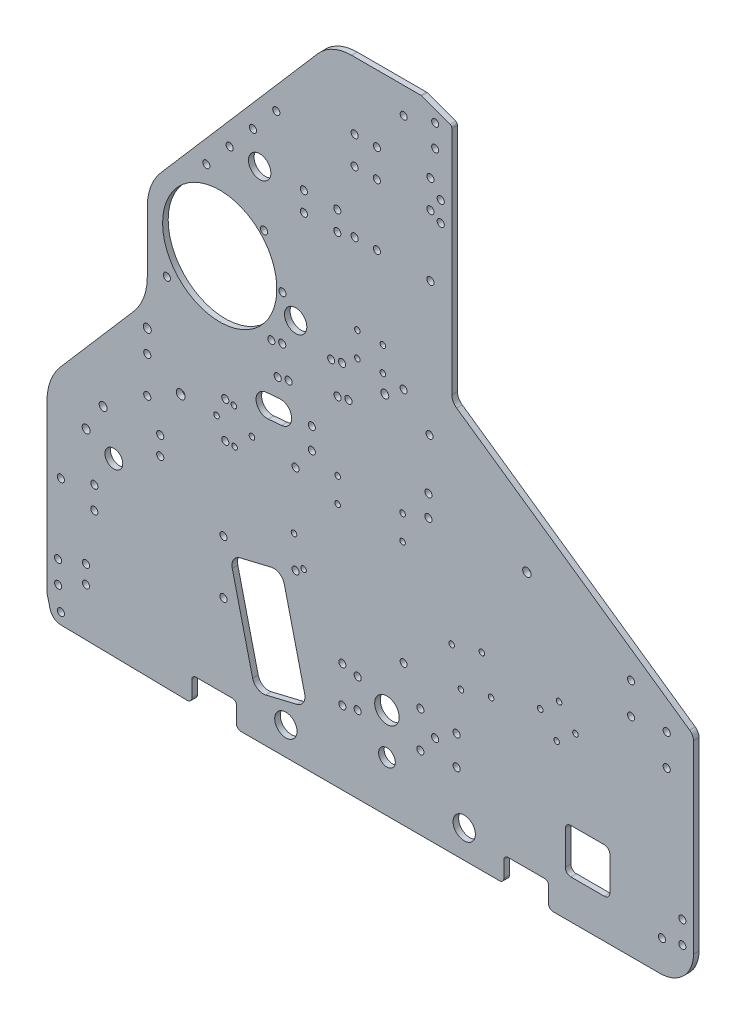
from build123d import *

# Parameters (mm, degrees)
SKETCH1_R           = 2.032
SKETCH1_R_2         = 5.08
SKETCH1_R_3         = 2.54
SKETCH1_R_4         = 2
BOSS_EXTRUDE1_DEPTH = 3.175
FILLET1_R           = 2.286
FILLET2_R           = 6.35
SKETCH2_R           = 2.032
CUT_EXTRUDE1_DEPTH  = 505.524983177
FILLET3_R           = 1.5875
SKETCH3_R           = 2.286
SKETCH3_R_2         = 2.032
SKETCH3_R_3         = 6.35
CUT_EXTRUDE2_DEPTH  = 505.524983177
SKETCH4_R           = 2.032
SKETCH4_R_2         = 6.985
SKETCH4_R_3         = 4.7625
CUT_EXTRUDE3_DEPTH  = 505.524983177
SKETCH5_R           = 32.54375
SKETCH5_R_2         = 6.35
SKETCH5_R_3         = 2.39
CUT_EXTRUDE5_DEPTH  = 505.524983177
FILLET4_R           = 31.75
CUT_EXTRUDE6_DEPTH  = 505.524983177
FILLET5_R           = 25.4
SKETCH8_R           = 2.031999998
SKETCH8_R_2         = 2.031999999
SKETCH8_R_3         = 2.032000002
CUT_EXTRUDE7_DEPTH  = 505.524983177
SKETCH10_R          = 2.032000004
CUT_EXTRUDE8_DEPTH  = 505.524983177
SKETCH11_RX         = 2.032
SKETCH11_RY         = 2.031999502
CUT_EXTRUDE9_DEPTH  = 505.524983177
SKETCH12_R          = 2.032
CUT_EXTRUDE10_DEPTH = 505.524983319
SKETCH14_R          = 6.375981846
CUT_EXTRUDE11_DEPTH = 505.524983319
SKETCH15_R          = 2.286
SKETCH15_R_2        = 2.159
CUT_EXTRUDE12_DEPTH = 505.524983319
FILLET7_R           = 5.08
FILLET8_R           = 2.54
SKETCH17_R          = 2.032
CUT_EXTRUDE13_DEPTH = 505.524983319
FILLET9_R           = 19.05
SKETCH18_R          = 1.5875
CUT_EXTRUDE14_DEPTH = 505.524983319


with BuildPart() as part:
    # Sketch1 → Boss-Extrude1 (new body)
    with BuildSketch(Plane.XY):
        with BuildLine():
            Line((7.829508682, -19.049081656), (82.55, -20.32))
            Line((82.55, -20.32), (82.55, -6.35))
            Line((82.55, -6.35), (107.95, -6.35))
            Line((107.95, -6.35), (107.95, -20.32))
            Line((107.95, -20.32), (260.35, -20.32))
            Line((260.35, -20.32), (260.35, -6.35))
            Line((260.35, -6.35), (285.75, -6.35))
            Line((285.75, -6.35), (285.75, -20.32))
            Line((285.75, -20.32), (368.3, -20.32))
            Line((368.3, -20.32), (368.3, 106.68))
            Line((368.3, 106.68), (230.66375, 202.565))
            Line((230.66375, 202.565), (230.66375, 338.455))
            Line((230.66375, 338.455), (213.19998, 344.805))
            Line((213.19998, 344.805), (203.2, 344.805))
            Line((203.2, 344.805), (161.925, 344.805))
            Line((161.925, 344.805), (52.720122664, 218.469945827))
            ThreePointArc((52.720122664, 218.469945827), (52.803835479, 218.142145922), (52.832, 217.805))
            ThreePointArc((52.832, 217.805), (52.095493096, 216.239521914), (50.419872403, 215.808871996))
            Line((50.419872403, 215.808871996), (0, 157.48))
            Line((0, 157.48), (0, 0))
            Line((0, 0), (0, -6.35))
            ThreePointArc((0, -6.35), (0.047577015, -7.125863724), (0.189595124, -7.890101219))
            Line((0.189595124, -7.890101219), (1.777095124, -14.240101219))
            ThreePointArc((1.777095124, -14.240101219), (3.987212552, -17.671692778), (7.829508682, -19.049081656))
        make_face()
        with Locations((7.9375, -12.7)):
            Circle(SKETCH1_R, mode=Mode.SUBTRACT)
        with Locations((6.35, 0)):
            Circle(SKETCH1_R, mode=Mode.SUBTRACT)
        with Locations((6.35, 12.7)):
            Circle(SKETCH1_R, mode=Mode.SUBTRACT)
        with Locations((38.1, 78.105)):
            Circle(SKETCH1_R_2, mode=Mode.SUBTRACT)
        with Locations((57.15, 118.58625)):
            Circle(SKETCH1_R, mode=Mode.SUBTRACT)
        with Locations((57.15, 139.22375)):
            Circle(SKETCH1_R, mode=Mode.SUBTRACT)
        with Locations((76.2, 128.905)):
            Circle(SKETCH1_R_3, mode=Mode.SUBTRACT)
        with Locations((101.6, 118.58625)):
            Circle(SKETCH1_R, mode=Mode.SUBTRACT)
        with Locations((101.6, 139.22375)):
            Circle(SKETCH1_R, mode=Mode.SUBTRACT)
        with BuildLine():
            ThreePointArc((126.021631534, 141.585225308), (119.142356235, 147.357622674), (124.914753602, 154.236897973))
            Line((124.914753602, 154.236897973), (132.505757201, 154.901024733))
            ThreePointArc((132.505757201, 154.901024733), (139.3850325, 149.128627367), (133.612635134, 142.249352067))
            Line((133.612635134, 142.249352067), (126.021631534, 141.585225308))
        make_face(mode=Mode.SUBTRACT)
        with Locations((203.2, 59.805)):
            Circle(SKETCH1_R_4, mode=Mode.SUBTRACT)
        with Locations((350.339487758, -2.359487758)):
            Circle(SKETCH1_R, mode=Mode.SUBTRACT)
        with Locations((361.95, 0)):
            Circle(SKETCH1_R, mode=Mode.SUBTRACT)
        with Locations((361.95, 12.7)):
            Circle(SKETCH1_R, mode=Mode.SUBTRACT)
        with Locations((353.06, 82.955052336)):
            Circle(SKETCH1_R, mode=Mode.SUBTRACT)
        with Locations((332.74, 98.195052336)):
            Circle(SKETCH1_R, mode=Mode.SUBTRACT)
        with Locations((332.74, 115.975052336)):
            Circle(SKETCH1_R, mode=Mode.SUBTRACT)
        with Locations((353.06, 100.735052336)):
            Circle(SKETCH1_R, mode=Mode.SUBTRACT)
        with Locations((68.326, 182.923674932)):
            Circle(SKETCH1_R, mode=Mode.SUBTRACT)
        with Locations((76.2, 217.805)):
            Circle(SKETCH1_R, mode=Mode.SUBTRACT)
        with Locations((90.779500502, 249.682)):
            Circle(SKETCH1_R, mode=Mode.SUBTRACT)
        with Locations((104.067838673, 265.054783374)):
            Circle(SKETCH1_R, mode=Mode.SUBTRACT)
        with Locations((117.356176844, 280.427566748)):
            Circle(SKETCH1_R, mode=Mode.SUBTRACT)
        with Locations((130.644515014, 295.800350122)):
            Circle(SKETCH1_R, mode=Mode.SUBTRACT)
        with Locations((203.2, 194.805)):
            Circle(SKETCH1_R_4, mode=Mode.SUBTRACT)
        with Locations((224.31375, 287.401)):
            Circle(SKETCH1_R, mode=Mode.SUBTRACT)
        with Locations((224.31375, 298.831)):
            Circle(SKETCH1_R, mode=Mode.SUBTRACT)
        with Locations((203.2, 329.805)):
            Circle(SKETCH1_R_4, mode=Mode.SUBTRACT)
        with Locations((221.138115, 322.58)):
            Circle(SKETCH1_R_4, mode=Mode.SUBTRACT)
        with Locations((221.138115, 335.28)):
            Circle(SKETCH1_R_4, mode=Mode.SUBTRACT)
    extrude(amount=BOSS_EXTRUDE1_DEPTH)

    # Fillet1
    fillet1_edges = [part.edges().sort_by_distance(p)[0] for p in [
        (285.75, -6.35, 1.5875),
        (260.35, -6.35, 1.5875),
        (107.95, -6.35, 1.5875),
        (82.55, -6.35, 1.5875),
    ]]
    fillet(fillet1_edges, radius=FILLET1_R)

    # Fillet2
    fillet2_edges = [part.edges().sort_by_distance(p)[0] for p in [
        (230.66375, 202.565, 1.5875),
    ]]
    fillet(fillet2_edges, radius=FILLET2_R)

    # Sketch2 → Cut-Extrude1 (cut, through all)
    with BuildSketch(Plane(origin=(0, 0, 0), x_dir=(-1, 0, 0), z_dir=(0, 0, -1))):
        with Locations((-100.552770272, 71.086035298)):
            Circle(SKETCH2_R)
        with Locations((-100.552770272, 40.606035298)):
            Circle(SKETCH2_R)
        with Locations((-22.225, 18.202541089)):
            Circle(SKETCH2_R)
        with Locations((-22.225, 8.042541089)):
            Circle(SKETCH2_R)
    extrude(amount=-CUT_EXTRUDE1_DEPTH, mode=Mode.SUBTRACT)

    # Fillet3
    fillet3_edges = [part.edges().sort_by_distance(p)[0] for p in [
        (213.19998, 344.805, 1.5875),
        (230.66375, 338.455, 1.5875),
    ]]
    fillet(fillet3_edges, radius=FILLET3_R)

    # Sketch3 → Cut-Extrude2 (cut, through all)
    # profile 1 of 13: a face of its own
    with BuildSketch(Plane.XY.offset(3.175)):
        with BuildLine():
            ThreePointArc((135.191487602, 64.820218836), (132.61355403, 68.506323892), (128.21466788, 69.445958198))
            ThreePointArc((128.21466788, 69.445958198), (128.001247395, 69.406624891), (127.789350211, 69.359774106))
            Line((127.789350211, 69.359774106), (110.090750339, 65.117184968))
            ThreePointArc((110.090750339, 65.117184968), (109.880641165, 65.062875232), (109.672582475, 65.00117439))
            ThreePointArc((109.672582475, 65.00117439), (106.177773017, 62.169316548), (105.55119507, 57.715047577))
            Line((105.55119507, 57.715047577), (105.782168144, 56.751508593))
            Line((105.782168144, 56.751508593), (116.9290648, 10.25054955))
            Line((116.9290648, 10.25054955), (117.160037875, 9.287010566))
            ThreePointArc((117.160037875, 9.287010566), (119.737971447, 5.60090551), (124.136857596, 4.661271205))
            ThreePointArc((124.136857596, 4.661271205), (124.350278082, 4.700604512), (124.562175266, 4.747455297))
            Line((124.562175266, 4.747455297), (142.260775137, 8.990044434))
            ThreePointArc((142.260775137, 8.990044434), (142.470884312, 9.044354171), (142.678943002, 9.106055013))
            ThreePointArc((142.678943002, 9.106055013), (146.17375246, 11.937912855), (146.800330407, 16.392181825))
            Line((146.800330407, 16.392181825), (146.569357332, 17.355720809))
            Line((146.569357332, 17.355720809), (135.422460676, 63.856679852))
            Line((135.422460676, 63.856679852), (135.191487602, 64.820218836))
        make_face()
        with BuildLine():
            ThreePointArc((123.720705737, 7.166948285), (123.84583827, 7.190010159), (123.970077661, 7.217479674))
            Line((123.970077661, 7.217479674), (141.668677532, 11.460068812))
            ThreePointArc((141.668677532, 11.460068812), (141.791868579, 11.491911654), (141.913857388, 11.528088044))
            ThreePointArc((141.913857388, 11.528088044), (143.962931337, 13.18846072), (144.330306029, 15.80008422))
            Line((144.330306029, 15.80008422), (144.099332955, 16.763623204))
            Line((144.099332955, 16.763623204), (132.952436299, 63.264582247))
            Line((132.952436299, 63.264582247), (132.721463224, 64.228121231))
            ThreePointArc((132.721463224, 64.228121231), (131.209971228, 66.389355466), (128.630819739, 66.940281117))
            ThreePointArc((128.630819739, 66.940281117), (128.505687207, 66.917219244), (128.381447816, 66.889749728))
            Line((128.381447816, 66.889749728), (110.682847944, 62.647160591))
            ThreePointArc((110.682847944, 62.647160591), (110.559656897, 62.615317748), (110.437668089, 62.579141359))
            ThreePointArc((110.437668089, 62.579141359), (108.388594139, 60.918768683), (108.021219448, 58.307145182))
            Line((108.021219448, 58.307145182), (108.252192522, 57.343606198))
            Line((108.252192522, 57.343606198), (119.399089178, 10.842647155))
            Line((119.399089178, 10.842647155), (119.630062252, 9.879108171))
            ThreePointArc((119.630062252, 9.879108171), (121.141554249, 7.717873936), (123.720705737, 7.166948285))
        make_face(mode=Mode.SUBTRACT)
    # profile 2 of 13: a face of its own
    with BuildSketch(Plane.XY.offset(3.175)):
        with BuildLine():
            ThreePointArc((119.630062252, 9.879108171), (121.141554249, 7.717873936), (123.720705737, 7.166948285))
            ThreePointArc((123.720705737, 7.166948285), (123.84583827, 7.190010159), (123.970077661, 7.217479674))
            Line((123.970077661, 7.217479674), (141.668677532, 11.460068812))
            ThreePointArc((141.668677532, 11.460068812), (141.791868579, 11.491911654), (141.913857388, 11.528088044))
            ThreePointArc((141.913857388, 11.528088044), (143.962931337, 13.18846072), (144.330306029, 15.80008422))
            Line((144.330306029, 15.80008422), (144.099332955, 16.763623204))
            Line((144.099332955, 16.763623204), (132.952436299, 63.264582247))
            Line((132.952436299, 63.264582247), (132.721463224, 64.228121231))
            ThreePointArc((132.721463224, 64.228121231), (131.209971228, 66.389355466), (128.630819739, 66.940281117))
            ThreePointArc((128.630819739, 66.940281117), (128.505687207, 66.917219244), (128.381447816, 66.889749728))
            Line((128.381447816, 66.889749728), (110.682847944, 62.647160591))
            ThreePointArc((110.682847944, 62.647160591), (110.559656897, 62.615317748), (110.437668089, 62.579141359))
            ThreePointArc((110.437668089, 62.579141359), (108.388594139, 60.918768683), (108.021219448, 58.307145182))
            Line((108.021219448, 58.307145182), (108.252192522, 57.343606198))
            Line((108.252192522, 57.343606198), (119.399089178, 10.842647155))
            Line((119.399089178, 10.842647155), (119.630062252, 9.879108171))
        make_face()
        with BuildLine():
            add(Edge.make_bspline(
                [(137.838301681, 15.683526575), (141.086601391, 16.4621871), (140.016434861, 20.926548037)],
                knots=[6.015286395, 6.015286395, 6.015286395, 6.934634014, 6.934634014, 6.934634014], degree=2, weights=[1, 0.896197261, 1]))
            Line((140.016434861, 20.926548037), (131.200631138, 57.703001655))
            add(Edge.make_bspline(
                [(131.200631138, 57.703001655), (130.130464608, 62.167362592), (126.882164897, 61.388702067)],
                knots=[2.490143946, 2.490143946, 2.490143946, 3.409491566, 3.409491566, 3.409491566], degree=2, weights=[1, 0.896197261, 1]))
            Line((126.882164897, 61.388702067), (114.513223796, 58.423702828))
            add(Edge.make_bspline(
                [(114.513223796, 58.423702828), (111.264924085, 57.645042303), (112.335090616, 53.180681366)],
                knots=[2.873693741, 2.873693741, 2.873693741, 3.793041361, 3.793041361, 3.793041361], degree=2, weights=[1, 0.896197261, 1]))
            Line((112.335090616, 53.180681366), (121.150894339, 16.404227747))
            add(Edge.make_bspline(
                [(121.150894339, 16.404227747), (122.221060869, 11.93986681), (125.46936058, 12.718527335)],
                knots=[2.490143946, 2.490143946, 2.490143946, 3.409491566, 3.409491566, 3.409491566], degree=2, weights=[1, 0.896197261, 1]))
            Line((125.46936058, 12.718527335), (137.838301681, 15.683526575))
        make_face(mode=Mode.SUBTRACT)
    # profile 3 of 13: a face of its own
    with BuildSketch(Plane.XY.offset(3.175)):
        with BuildLine():
            Line((137.838301681, 15.683526575), (125.46936058, 12.718527335))
            add(Edge.make_bspline(
                [(121.150894339, 16.404227747), (122.221060869, 11.93986681), (125.46936058, 12.718527335)],
                knots=[2.490143946, 2.490143946, 2.490143946, 3.409491566, 3.409491566, 3.409491566], degree=2, weights=[1, 0.896197261, 1]))
            Line((121.150894339, 16.404227747), (112.335090616, 53.180681366))
            add(Edge.make_bspline(
                [(114.513223796, 58.423702828), (111.264924085, 57.645042303), (112.335090616, 53.180681366)],
                knots=[2.873693741, 2.873693741, 2.873693741, 3.793041361, 3.793041361, 3.793041361], degree=2, weights=[1, 0.896197261, 1]))
            Line((114.513223796, 58.423702828), (126.882164897, 61.388702067))
            add(Edge.make_bspline(
                [(131.200631138, 57.703001655), (130.130464608, 62.167362592), (126.882164897, 61.388702067)],
                knots=[2.490143946, 2.490143946, 2.490143946, 3.409491566, 3.409491566, 3.409491566], degree=2, weights=[1, 0.896197261, 1]))
            Line((131.200631138, 57.703001655), (140.016434861, 20.926548037))
            add(Edge.make_bspline(
                [(137.838301681, 15.683526575), (141.086601391, 16.4621871), (140.016434861, 20.926548037)],
                knots=[6.015286395, 6.015286395, 6.015286395, 6.934634014, 6.934634014, 6.934634014], degree=2, weights=[1, 0.896197261, 1]))
        make_face()
    # profile 4 of 13: a face of its own
    with BuildSketch(Plane.XY.offset(3.175)):
        with Locations((32.030600949, 100.810868853)):
            Circle(SKETCH3_R)
    # profile 5 of 13: a face of its own
    with BuildSketch(Plane.XY.offset(3.175)):
        with Locations((64.525942114, 92.525786339)):
            Circle(SKETCH3_R_2)
    # profile 6 of 13: a face of its own
    with BuildSketch(Plane.XY.offset(3.175)):
        with Locations((64.525942114, 102.94048958)):
            Circle(SKETCH3_R_2)
    # profile 7 of 13: a face of its own
    with BuildSketch(Plane.XY.offset(3.175)):
        with Locations((7.937500002, 53.303113935)):
            Circle(SKETCH3_R_2)
    # profile 8 of 13: a face of its own
    with BuildSketch(Plane.XY.offset(3.175)):
        with Locations((26.987500002, 59.653113935)):
            Circle(SKETCH3_R_2)
    # profile 9 of 13: a face of its own
    with BuildSketch(Plane.XY.offset(3.175)):
        with Locations((26.987500002, 46.953113935)):
            Circle(SKETCH3_R_2)
    # profile 10 of 13: a face of its own
    with BuildSketch(Plane.XY.offset(3.175)):
        with Locations((123.681970341, 233.485092108)):
            Circle(SKETCH3_R_2)
    # profile 11 of 13: a face of its own
    with BuildSketch(Plane.XY.offset(3.175)):
        with Locations((134.14375, 208.228121768)):
            Circle(SKETCH3_R_2)
    # profile 12 of 13: a face of its own
    with BuildSketch(Plane.XY.offset(3.175)):
        with Locations((136.094563167, -4.324155877)):
            Circle(SKETCH3_R_3)
    # profile 13 of 13: a face of its own
    with BuildSketch(Plane.XY.offset(3.175)):
        with Locations((237.694563167, -4.324155877)):
            Circle(SKETCH3_R_3)
    extrude(amount=-CUT_EXTRUDE2_DEPTH, mode=Mode.SUBTRACT)

    # Sketch4 → Cut-Extrude3 (cut, through all)
    with BuildSketch(Plane.XY.offset(3.175)):
        with Locations((168.275, 42.06875)):
            Circle(SKETCH4_R)
        with Locations((212.725, 42.06875)):
            Circle(SKETCH4_R)
        with Locations((212.725, 21.43125)):
            Circle(SKETCH4_R)
        with Locations((168.275, 21.43125)):
            Circle(SKETCH4_R)
        with Locations((193.675, 31.75)):
            Circle(SKETCH4_R_2)
        with Locations((177.00498, 40.0431)):
            Circle(SKETCH4_R)
        with Locations((177.00498, 23.4569)):
            Circle(SKETCH4_R)
        with Locations((193.675, 8.466666658)):
            Circle(SKETCH4_R_3)
        with Locations((221.138115, 31.75)):
            Circle(SKETCH4_R)
        with Locations((233.36123, 23.4569)):
            Circle(SKETCH4_R)
        with Locations((233.36123, 40.0431)):
            Circle(SKETCH4_R)
    extrude(amount=-CUT_EXTRUDE3_DEPTH, mode=Mode.SUBTRACT)

    # Sketch5 → Cut-Extrude5 (cut, through all)
    with BuildSketch(Plane(origin=(0, 0, 0), x_dir=(-1, 0, 0), z_dir=(0, 0, -1))):
        with Locations((-98.425, 208.228121768)):
            Circle(SKETCH5_R)
        with Locations((-141.675587431, 197.971943782)):
            Circle(SKETCH5_R_2)
        with Locations((-273.4056, 139.72794)):
            Circle(SKETCH5_R_3)
        Polygon((-57.15, 223.594705882), (-57.15, 165.333696112), (0, 99.218990229), (0, 157.48), align=None)
    extrude(amount=-CUT_EXTRUDE5_DEPTH, mode=Mode.SUBTRACT)

    # Fillet4
    fillet4_edges = [part.edges().sort_by_distance(p)[0] for p in [
        (57.15, 223.594705882, 1.5875),
        (0, 99.218990229, 1.5875),
        (57.15, 165.333696112, 1.5875),
    ]]
    fillet(fillet4_edges, radius=FILLET4_R)

    # Sketch6 → Cut-Extrude6 (cut, through all)
    with BuildSketch(Plane.XY.offset(3.175)):
        with BuildLine():
            Line((298.45, 27.305), (317.5, 27.305))
            ThreePointArc((317.5, 27.305), (319.74506403, 26.37506403), (320.675, 24.13))
            Line((320.675, 24.13), (320.675, 5.08))
            ThreePointArc((320.675, 5.08), (319.74506403, 2.83493597), (317.5, 1.905))
            Line((317.5, 1.905), (298.45, 1.905))
            ThreePointArc((298.45, 1.905), (296.20493597, 2.83493597), (295.275, 5.08))
            Line((295.275, 5.08), (295.275, 24.13))
            ThreePointArc((295.275, 24.13), (296.20493597, 26.37506403), (298.45, 27.305))
        make_face()
    extrude(amount=-CUT_EXTRUDE6_DEPTH, mode=Mode.SUBTRACT)

    # Fillet5
    fillet5_edges = [part.edges().sort_by_distance(p)[0] for p in [
        (161.925, 344.805, 1.5875),
    ]]
    fillet(fillet5_edges, radius=FILLET5_R)

    # Sketch8 → Cut-Extrude7 (cut, through all)
    with BuildSketch(Plane(origin=(0, 0, 0), x_dir=(-1, 0, 0), z_dir=(0, 0, -1))):
        with Locations((-218.44, 306.70500001)):
            Circle(SKETCH8_R)
        with Locations((-175.26, 306.70500001)):
            Circle(SKETCH8_R_2)
        with Locations((-175.26, 255.905)):
            Circle(SKETCH8_R_3)
        with Locations((-218.44, 255.905)):
            Circle(SKETCH8_R_3)
        with Locations((-187.96, 306.70500001)):
            Circle(SKETCH8_R_2)
        with Locations((-187.96, 255.905)):
            Circle(SKETCH8_R_3)
        with Locations((-218.44, 290.83)):
            Circle(SKETCH8_R_3)
        with Locations((-187.96, 290.83)):
            Circle(SKETCH8_R_3)
        with Locations((-175.26, 290.83)):
            Circle(SKETCH8_R_3)
    extrude(amount=-CUT_EXTRUDE7_DEPTH, mode=Mode.SUBTRACT)

    # Sketch10 → Cut-Extrude8 (cut, through all)
    with BuildSketch(Plane.XY.offset(3.175)):
        with Locations((141.642479994, 74.684371768)):
            Circle(SKETCH10_R)
        with Locations((141.642479994, 125.484371768)):
            Circle(SKETCH10_R)
    extrude(amount=-CUT_EXTRUDE8_DEPTH, mode=Mode.SUBTRACT)

    # Sketch11 → Cut-Extrude9 (cut, through all)
    with BuildSketch(Plane.XY.offset(3.175)):
        with Locations(Location((150.881424454, 138.43), (0, 0, 90))):
            Ellipse(SKETCH11_RX, SKETCH11_RY)
        with Locations(Location((150.881424454, 150.495), (0, 0, 90))):
            Ellipse(SKETCH11_RX, SKETCH11_RY)
        with Locations(Location((217.30240818, 150.495), (0, 0, 90))):
            Ellipse(SKETCH11_RX, SKETCH11_RY)
        with Locations(Location((217.30240818, 138.43), (0, 0, 90))):
            Ellipse(SKETCH11_RX, SKETCH11_RY)
    extrude(amount=-CUT_EXTRUDE9_DEPTH, mode=Mode.SUBTRACT)

    # Sketch12 → Cut-Extrude10 (cut, through all)
    with BuildSketch(Plane(origin=(0, 0, 0), x_dir=(-1, 0, 0), z_dir=(0, 0, -1))):
        with Locations((-165.4175, 264.63498)):
            Circle(SKETCH12_R)
        with Locations((-165.4175, 253.52248)):
            Circle(SKETCH12_R)
        with Locations((-146.3675, 253.52248)):
            Circle(SKETCH12_R)
        with Locations((-146.3675, 264.63498)):
            Circle(SKETCH12_R)
    extrude(amount=-CUT_EXTRUDE10_DEPTH, mode=Mode.SUBTRACT)

    # Sketch14 → Cut-Extrude11 (cut, through all)
    with BuildSketch(Plane(origin=(0, 0, 0), x_dir=(-1, 0, 0), z_dir=(0, 0, -1))):
        with Locations((-121.184716432, 263.688494682)):
            Circle(SKETCH14_R)
    extrude(amount=-CUT_EXTRUDE11_DEPTH, mode=Mode.SUBTRACT)

    # Sketch15 → Cut-Extrude12 (cut, through all)
    with BuildSketch(Plane.XY.offset(3.175)):
        with Locations((57.149999979, 151.92375)):
            Circle(SKETCH15_R)
        with Locations((192.439038935, 187.119947783)):
            Circle(SKETCH15_R)
        with Locations((38.100000021, 78.105)):
            Circle(SKETCH15_R_2)
        with Locations((22.359447548, 84.872674248)):
            Circle(SKETCH15_R)
        with BuildLine():
            ThreePointArc((163.873739907, 173.680575348), (163.573171678, 172.102507308), (164.512499377, 170.799317578))
            ThreePointArc((164.512499377, 170.799317578), (167.54083865, 172.982117899), (163.873739907, 173.680575348))
        make_face()
        with BuildLine():
            ThreePointArc((173.439750066, 172.778441407), (173.740318296, 174.356509448), (172.800990596, 175.659699178))
            ThreePointArc((172.800990596, 175.659699178), (169.772651323, 173.476898857), (173.439750066, 172.778441407))
        make_face()
        with BuildLine():
            ThreePointArc((169.158852993, 192.088320238), (166.130513719, 189.905519916), (169.797612462, 189.207062467))
            ThreePointArc((169.797612462, 189.207062467), (170.098180692, 190.785130507), (169.158852993, 192.088320238))
        make_face()
        with BuildLine():
            ThreePointArc((160.231602304, 190.109196408), (159.931034074, 188.531128368), (160.870361773, 187.227938637))
            ThreePointArc((160.870361773, 187.227938637), (163.898701047, 189.410738959), (160.231602304, 190.109196408))
        make_face()
        with BuildLine():
            ThreePointArc((129.776601859, 166.121421831), (129.476033629, 164.543353791), (130.415361328, 163.240164061))
            ThreePointArc((130.415361328, 163.240164061), (133.443700602, 165.422964382), (129.776601859, 166.121421831))
        make_face()
        with BuildLine():
            ThreePointArc((139.342612017, 165.219287891), (139.643180247, 166.797355931), (138.703852548, 168.100545661))
            ThreePointArc((138.703852548, 168.100545661), (135.675513274, 165.91774534), (139.342612017, 165.219287891))
        make_face()
        with BuildLine():
            ThreePointArc((135.700474414, 181.64790895), (136.001042643, 183.225976991), (135.061714944, 184.529166721))
            ThreePointArc((135.061714944, 184.529166721), (132.033375671, 182.3463664), (135.700474414, 181.64790895))
        make_face()
        with BuildLine():
            ThreePointArc((126.134464255, 182.550042891), (125.833896025, 180.971974851), (126.773223725, 179.668785121))
            ThreePointArc((126.773223725, 179.668785121), (129.801562998, 181.851585442), (126.134464255, 182.550042891))
        make_face()
    extrude(amount=-CUT_EXTRUDE12_DEPTH, mode=Mode.SUBTRACT)

    # Fillet7
    fillet7_edges = [part.edges().sort_by_distance(p)[0] for p in [
        (368.3, 106.68, 1.5875),
    ]]
    fillet(fillet7_edges, radius=FILLET7_R)

    # Fillet8
    fillet8_edges = [part.edges().sort_by_distance(p)[0] for p in [
        (285.75, -20.32, 1.5875),
        (260.35, -20.32, 1.5875),
        (107.95, -20.32, 1.5875),
        (82.55, -20.32, 1.5875),
    ]]
    fillet(fillet8_edges, radius=FILLET8_R)

    # Sketch17 → Cut-Extrude13 (cut, through all)
    with BuildSketch(Plane.XY.offset(3.175)):
        with Locations((217.96375, 179.705)):
            Circle(SKETCH17_R)
    extrude(amount=-CUT_EXTRUDE13_DEPTH, mode=Mode.SUBTRACT)

    # Fillet9
    fillet9_edges = [part.edges().sort_by_distance(p)[0] for p in [
        (368.3, -20.32, 1.5875),
    ]]
    fillet(fillet9_edges, radius=FILLET9_R)

    # Sketch18 → Cut-Extrude14 (cut, through all)
    with BuildSketch(Plane.XY.offset(3.175)):
        with Locations((165.591916317, 119.38)):
            Circle(SKETCH18_R)
        with Locations((202.591916317, 119.38)):
            Circle(SKETCH18_R)
        with Locations((176.814816317, 210.82)):
            Circle(SKETCH18_R)
        with Locations((191.369016317, 210.82)):
            Circle(SKETCH18_R)
        with Locations((165.591916317, 133.35)):
            Circle(SKETCH18_R)
        with Locations((202.591916317, 133.35)):
            Circle(SKETCH18_R)
        with Locations((235.829835721, 63.104098689)):
            Circle(SKETCH18_R)
        with Locations((253.003996913, 67.705901311)):
            Circle(SKETCH18_R)
        with Locations((230.570632725, 82.731711479)):
            Circle(SKETCH18_R)
        with Locations((247.744793916, 87.333514101)):
            Circle(SKETCH18_R)
        with Locations((140.737131429, 92.548810178)):
            Circle(SKETCH18_R)
        with Locations((146.166701205, 77.631189823)):
            Circle(SKETCH18_R)
        with Locations((116.781916317, 128.27)):
            Circle(SKETCH18_R)
        with Locations((106.490542802, 138.561373515)):
            Circle(SKETCH18_R)
        with Locations((281.014286603, 76.059582017)):
            Circle(SKETCH18_R)
        with Locations((290.369546031, 64.910417983)):
            Circle(SKETCH18_R)
        with Locations((96.612261069, 128.683091782)):
            Circle(SKETCH18_R)
        with Locations((106.903634584, 118.391718267)):
            Circle(SKETCH18_R)
        with Locations((176.814816317, 196.85)):
            Circle(SKETCH18_R)
        with Locations((191.369016317, 196.85)):
            Circle(SKETCH18_R)
        with Locations((291.715927473, 85.039324924)):
            Circle(SKETCH18_R)
        with Locations((301.071186902, 73.89016089)):
            Circle(SKETCH18_R)
    extrude(amount=-CUT_EXTRUDE14_DEPTH, mode=Mode.SUBTRACT)


solid = part.part
